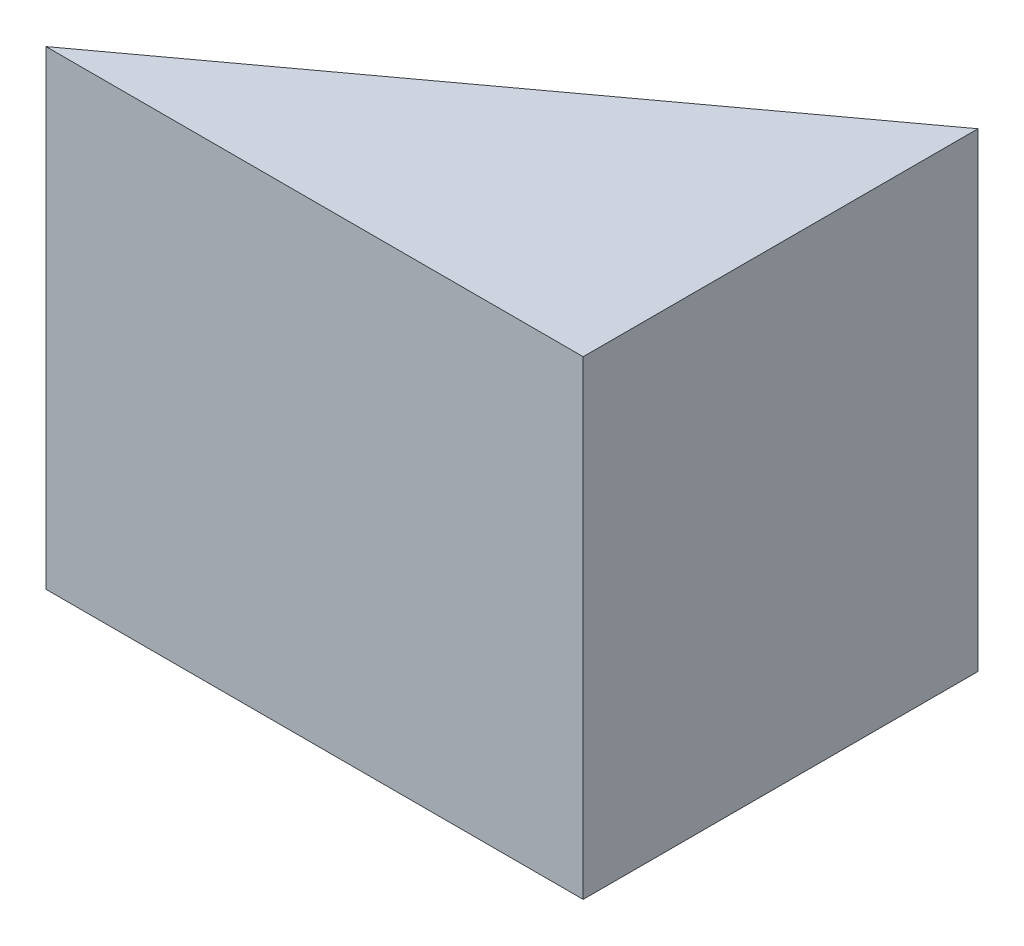
from build123d import *

# Parameters (mm, degrees)
BOSS_EXTRUDE2_DEPTH = 87.5


with BuildPart() as part:
    # Sketch2 → Boss-Extrude2 (new body)
    with BuildSketch(Plane(origin=(0, 0, 0), x_dir=(1, 0, 0), z_dir=(0, 1, 0))):
        Polygon((-60.028073005, 18.185004988), (39.971926995, 18.185004988), (39.971926995, 91.685004988), align=None)
    extrude(amount=BOSS_EXTRUDE2_DEPTH)


solid = part.part
